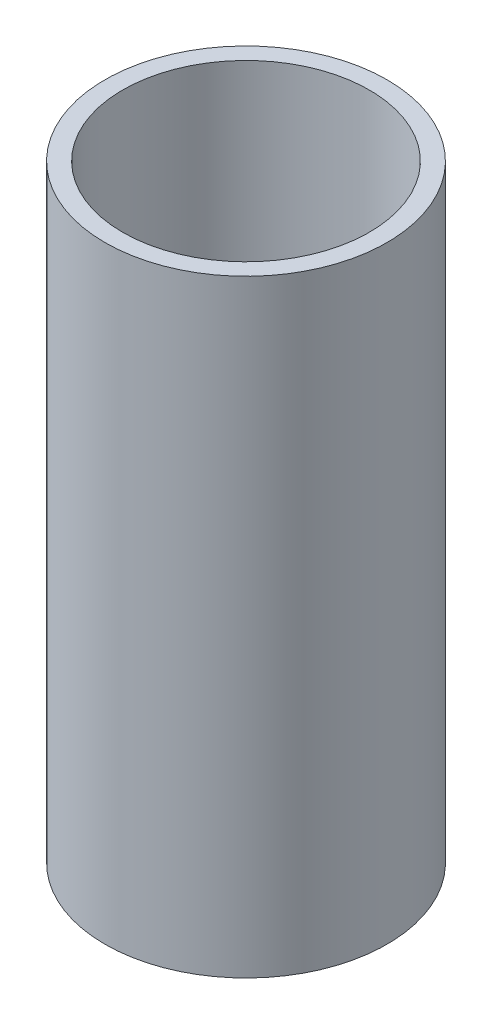
from build123d import *

# Parameters (mm, degrees)
SKETCH2_R           = 2.785
BOSS_EXTRUDE1_DEPTH = 12
SHELL1_T            = -0.35


with BuildPart() as part:
    # Sketch2 → Boss-Extrude1 (new body)
    with BuildSketch(Plane(origin=(0, 0, 0), x_dir=(1, 0, 0), z_dir=(0, 1, 0))):
        with Locations(Location((0, 0, 0), (0, 0, 270))):
            Circle(SKETCH2_R)
    extrude(amount=BOSS_EXTRUDE1_DEPTH)

    # Shell1
    shell1_openings = [part.faces().sort_by_distance(p)[0] for p in [
        (0, 12, 0),
        (0, 0, 0),
    ]]
    offset(amount=SHELL1_T, openings=shell1_openings, kind=Kind.INTERSECTION)


solid = part.part
